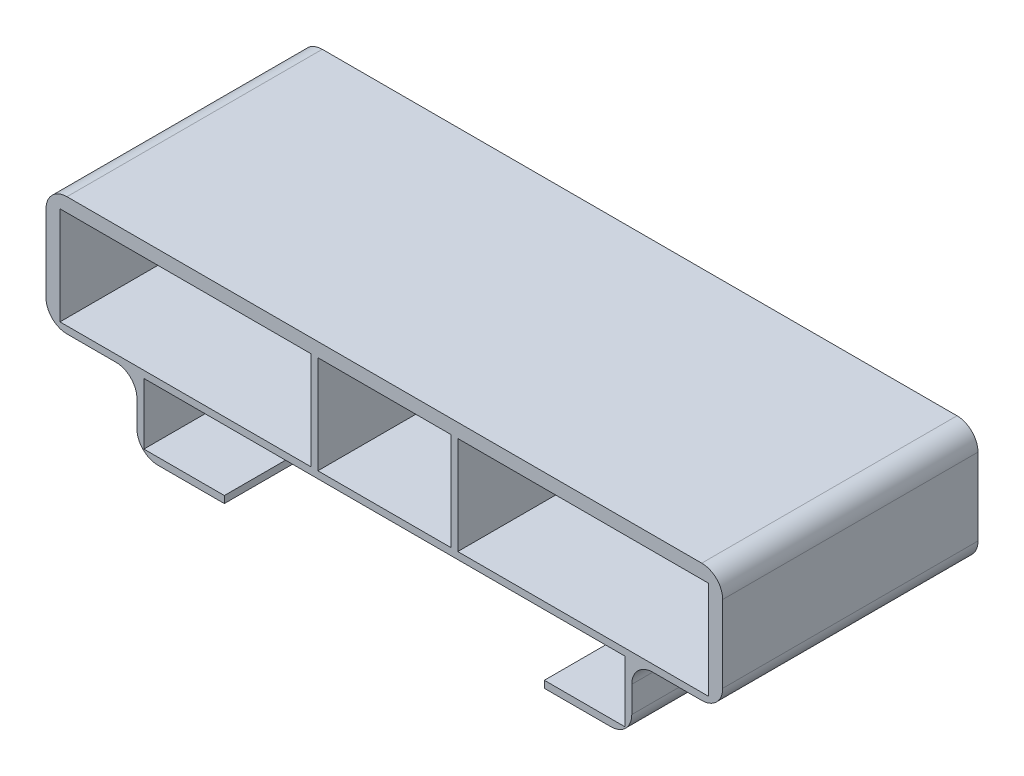
from build123d import *

# Parameters (mm, degrees)
SKETCH2_W            = 141.5
SKETCH2_H            = 21.5
BOSS_EXTRUDE1_DEPTH  = 73
SHELL1_T             = -2
CUT_EXTRUDE1_REACH   = 162.666
SKETCH3_W            = 91.5
SKETCH3_H            = 2
SKETCH7_W            = 73
SKETCH7_H            = 2
BOSS_EXTRUDE5_DEPTH  = 26
SKETCH8_W            = 73
SKETCH8_H            = 2
BOSS_EXTRUDE6_DEPTH  = 26
SKETCH9_W            = 4
SKETCH9_H            = 73
BOSS_EXTRUDE7_DEPTH  = 28
SKETCH10_W           = 193.5
SKETCH10_H           = 73
BOSS_EXTRUDE8_DEPTH  = 4
SKETCH11_W           = 2
SKETCH11_H           = 73
BOSS_EXTRUDE9_DEPTH  = 28
SKETCH13_W           = 38
SKETCH13_H           = 2
BOSS_EXTRUDE10_DEPTH = 28
FILLET1_R            = 6


with BuildPart() as part:
    # Sketch2 → Boss-Extrude1 (new body)
    with BuildSketch(Plane.XY):
        with Locations((70.75, -10.75)):
            Rectangle(SKETCH2_W, SKETCH2_H)
    extrude(amount=BOSS_EXTRUDE1_DEPTH)

    # Shell1
    shell1_openings = [part.faces().sort_by_distance(p)[0] for p in [
        (70.75, -10.75, 73),
    ]]
    offset(amount=SHELL1_T, openings=shell1_openings, kind=Kind.INTERSECTION)

    # Cut-Extrude1: up to this face of the body (flat: up to its plane)
    cut_extrude1_end = Plane(part.part.faces().sort_by_distance((70.75, -10.75, 0))[0])
    # Sketch3 → Cut-Extrude1 (cut, up to the picked face)
    with BuildSketch(Plane.XY.offset(73), mode=Mode.PRIVATE) as cut_extrude1_sk1:
        with Locations((70.75, -20.5)):
            Rectangle(SKETCH3_W, SKETCH3_H)
    cut_extrude1_tool1 = split(extrude(cut_extrude1_sk1.sketch, amount=-CUT_EXTRUDE1_REACH, mode=Mode.PRIVATE), bisect_by=cut_extrude1_end, keep=Keep.BOTH, mode=Mode.PRIVATE)
    add(cut_extrude1_tool1.solids().sort_by(Axis((70.75, -20.5, 73), (0, 0, -1)))[0], mode=Mode.SUBTRACT)

    # Sketch7 → Boss-Extrude5 (add)
    with BuildSketch(Plane.ZY):
        with Locations((36.5, -1)):
            Rectangle(SKETCH7_W, SKETCH7_H)
    extrude(amount=BOSS_EXTRUDE5_DEPTH)

    # Sketch8 → Boss-Extrude6 (add)
    with BuildSketch(Plane(origin=(141.5, 0, 0), x_dir=(0, 0, -1), z_dir=(1, 0, 0))):
        with Locations((-36.5, -1)):
            Rectangle(SKETCH8_W, SKETCH8_H)
    extrude(amount=BOSS_EXTRUDE6_DEPTH)

    # Sketch9 → Boss-Extrude7 (add)
    with BuildSketch(Plane(origin=(0, 0, 0), x_dir=(1, 0, 0), z_dir=(0, 1, 0))):
        with Locations((165.5, -36.5)):
            Rectangle(SKETCH9_W, SKETCH9_H)
        with Locations((-24, -36.5)):
            Rectangle(SKETCH9_W, SKETCH9_H)
    extrude(amount=BOSS_EXTRUDE7_DEPTH)

    # Sketch10 → Boss-Extrude8 (add)
    with BuildSketch(Plane(origin=(0, 28, 0), x_dir=(1, 0, 0), z_dir=(0, 1, 0))):
        with Locations((70.75, -36.5)):
            Rectangle(SKETCH10_W, SKETCH10_H)
    extrude(amount=BOSS_EXTRUDE8_DEPTH)

    # Sketch11 → Boss-Extrude9 (add)
    with BuildSketch(Plane(origin=(0, 0, 0), x_dir=(1, 0, 0), z_dir=(0, 1, 0))):
        with Locations((50.75, -36.5)):
            Rectangle(SKETCH11_W, SKETCH11_H)
        with Locations((90.75, -36.5)):
            Rectangle(SKETCH11_W, SKETCH11_H)
    extrude(amount=BOSS_EXTRUDE9_DEPTH)

    # Sketch13 → Boss-Extrude10 (add)
    with BuildSketch(Plane(origin=(0, 0, 0), x_dir=(1, 0, 0), z_dir=(0, 1, 0))):
        with Locations((70.75, -1)):
            Rectangle(SKETCH13_W, SKETCH13_H)
    extrude(amount=BOSS_EXTRUDE10_DEPTH)

    # Fillet1
    fillet1_edges = [part.edges().sort_by_distance(p)[0] for p in [
        (167.5, 32, 36.5),
        (0, -2, 36.5),
        (-26, -2, 36.5),
        (141.5, -2, 36.5),
        (167.5, -2, 36.5),
        (141.5, -21.5, 36.5),
        (0, -21.5, 36.5),
        (-26, 32, 36.5),
    ]]
    fillet(fillet1_edges, radius=FILLET1_R)


solid = part.part
